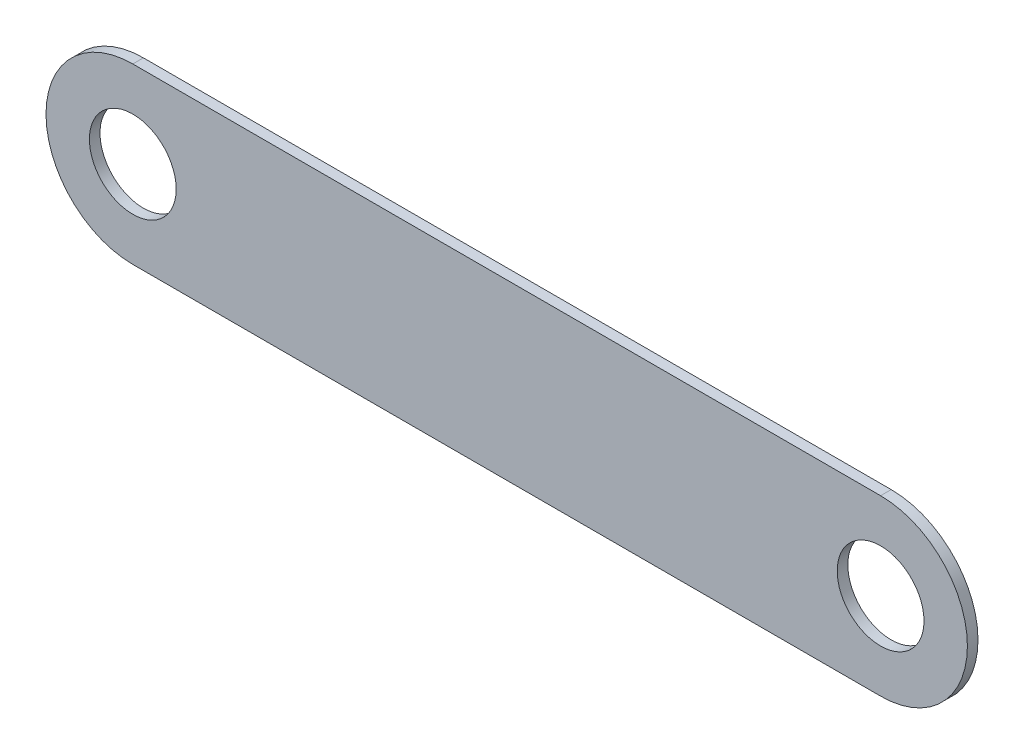
from build123d import *

# Parameters (mm, degrees)
SKETCH1_R           = 6.5
BOSS_EXTRUDE1_DEPTH = 1.5875


with BuildPart() as part:
    # Sketch1 → Boss-Extrude1 (new body)
    with BuildSketch(Plane.XY):
        with BuildLine():
            Line((0, 13), (112, 13))
            ThreePointArc((112, 13), (125, 0), (112, -13))
            Line((112, -13), (0, -13))
            ThreePointArc((0, -13), (-13, 0), (0, 13))
        make_face()
        Circle(SKETCH1_R, mode=Mode.SUBTRACT)
        with Locations((112, 0)):
            Circle(SKETCH1_R, mode=Mode.SUBTRACT)
    extrude(amount=BOSS_EXTRUDE1_DEPTH)


solid = part.part
